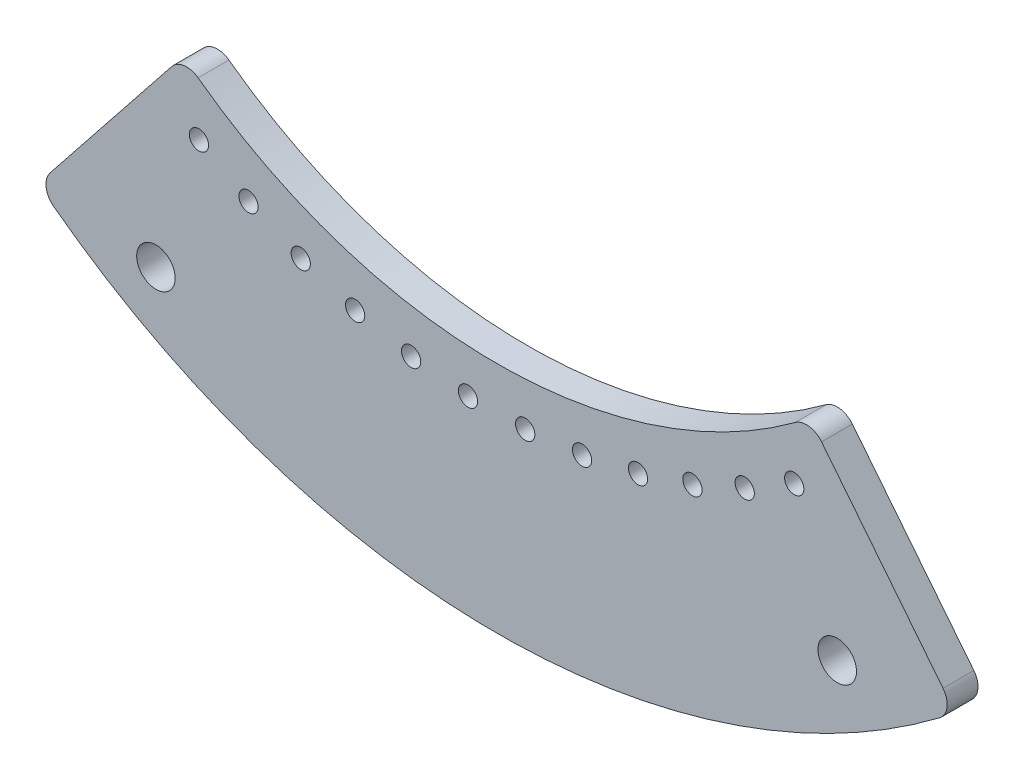
from build123d import *

# Parameters (mm, degrees)
BOSS_EXTRUDE2_DEPTH = 1.6
CUT_EXTRUDE3_START  = 1.6
SKETCH1_R           = 0.5
CUT_EXTRUDE3_DEPTH  = 47.684310176
CUT_EXTRUDE4_START  = 1.6
SKETCH3_R           = 1
CUT_EXTRUDE4_DEPTH  = 1.6
FILLET1_R           = 1


with BuildPart() as part:
    # Sketch2 → Boss-Extrude2 (new body)
    with BuildSketch(Plane.XY):
        with BuildLine():
            Line((-16.263194882, -20.445638098), (-23.811184851, -29.934762))
            ThreePointArc((-23.811184851, -29.934762), (0, -38.25), (23.811184851, -29.934762))
            Line((23.811184851, -29.934762), (16.263194882, -20.445638098))
            ThreePointArc((16.263194882, -20.445638098), (0, -26.125), (-16.263194882, -20.445638098))
        make_face()
    extrude(amount=BOSS_EXTRUDE2_DEPTH)

    # Sketch1 → Cut-Extrude3 (cut, through all)
    with BuildSketch(Plane.XY.offset(CUT_EXTRUDE3_START)):
        with Locations((-15.454132619, -23.797277365)):
            Circle(SKETCH1_R)
        with Locations((-12.88198043, -25.282310124)):
            Circle(SKETCH1_R)
        with Locations((-10.168690568, -26.490344602)):
            Circle(SKETCH1_R)
        with Locations((-7.343990405, -27.408145321)):
            Circle(SKETCH1_R)
        with Locations((-4.438827946, -28.025656664)):
            Circle(SKETCH1_R)
        with Locations((-1.485032758, -28.336113049)):
            Circle(SKETCH1_R)
        with Locations((1.485032758, -28.336113049)):
            Circle(SKETCH1_R)
        with Locations((4.438827946, -28.025656664)):
            Circle(SKETCH1_R)
        with Locations((7.343990405, -27.408145321)):
            Circle(SKETCH1_R)
        with Locations((10.168690568, -26.490344602)):
            Circle(SKETCH1_R)
        with Locations((12.88198043, -25.282310124)):
            Circle(SKETCH1_R)
        with Locations((15.454132619, -23.797277365)):
            Circle(SKETCH1_R)
    extrude(amount=-CUT_EXTRUDE3_DEPTH, mode=Mode.SUBTRACT)

    # Sketch3 → Cut-Extrude4 (cut)
    with BuildSketch(Plane.XY.offset(CUT_EXTRUDE4_START)):
        with Locations((-17.6875, -30.635648659)):
            Circle(SKETCH3_R)
        with Locations((17.6875, -30.635648659)):
            Circle(SKETCH3_R)
    extrude(amount=-CUT_EXTRUDE4_DEPTH, mode=Mode.SUBTRACT)

    # Fillet1
    fillet1_edges = [part.edges().sort_by_distance(p)[0] for p in [
        (16.263194882, -20.445638098, 0.8),
        (23.811184851, -29.934762, 0.8),
        (-23.811184851, -29.934762, 0.8),
        (-16.263194882, -20.445638098, 0.8),
    ]]
    fillet(fillet1_edges, radius=FILLET1_R)


solid = part.part
